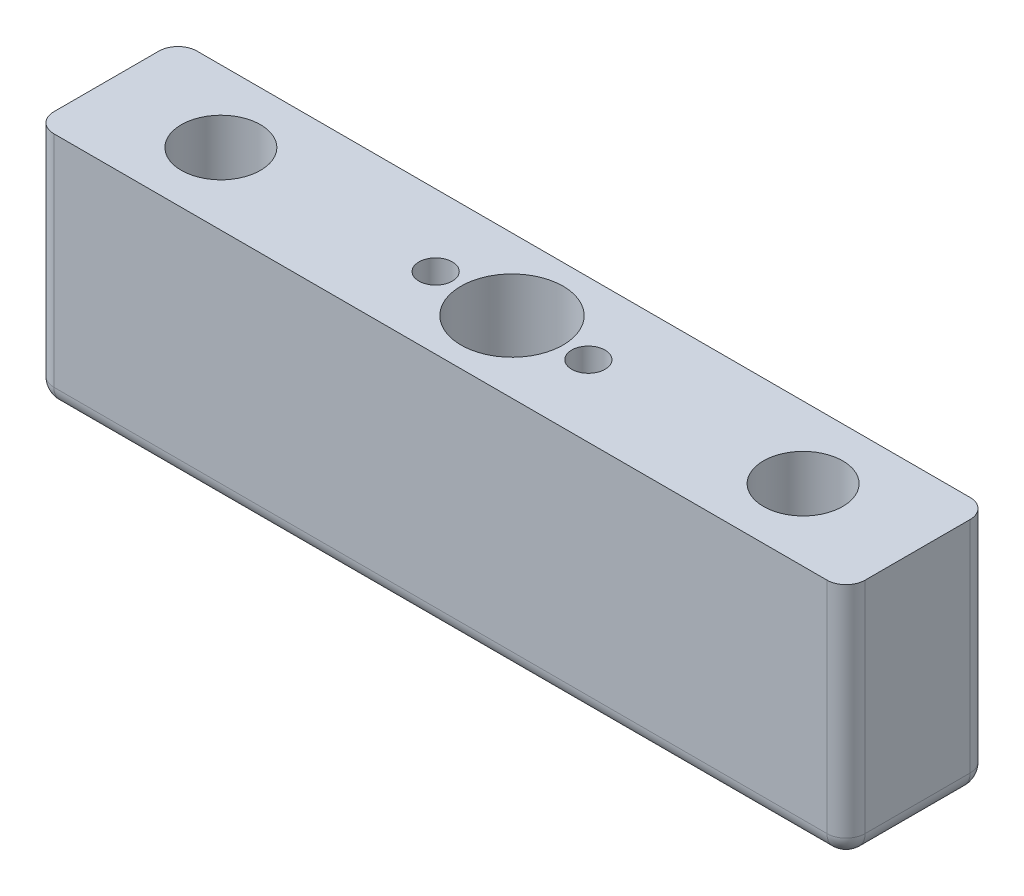
from build123d import *

# Parameters (mm, degrees)
CROQUIS1_W              = 85
CROQUIS1_H              = 15
SALIENTE_EXTRUIR1_DEPTH = 25
CROQUIS2_R              = 5.35
CORTAR_EXTRUIR1_DEPTH   = 50.874843358
CROQUIS3_R              = 4.15
CORTAR_EXTRUIR2_DEPTH   = 18
REDONDEO1_R             = 2
CROQUIS6_R              = 1.75
CORTAR_EXTRUIR4_DEPTH   = 50.874843358
CORTAR_EXTRUIR7_DEPTH   = 1


with BuildPart() as part:
    # Croquis1 → Saliente-Extruir1 (new body)
    with BuildSketch(Plane(origin=(0, 0, 0), x_dir=(1, 0, 0), z_dir=(0, 1, 0))):
        Rectangle(CROQUIS1_W, CROQUIS1_H)
    extrude(amount=SALIENTE_EXTRUIR1_DEPTH)

    # Croquis2 → Cortar-Extruir1 (cut, through all)
    with BuildSketch(Plane(origin=(0, 0, 0), x_dir=(-1, 0, 0), z_dir=(0, -1, 0))):
        with Locations(Location((0, 0, 0), (0, 0, 90))):
            Circle(CROQUIS2_R)
    extrude(amount=-CORTAR_EXTRUIR1_DEPTH, mode=Mode.SUBTRACT)

    # Croquis3 → Cortar-Extruir2 (cut)
    with BuildSketch(Plane(origin=(0, 25, 0), x_dir=(1, 0, 0), z_dir=(0, 1, 0))):
        with Locations(Location((-30.5, 0, 0), (0, 0, 270))):
            Circle(CROQUIS3_R)
        with Locations(Location((30.5, 0, 0), (0, 0, 270))):
            Circle(CROQUIS3_R)
    extrude(amount=-CORTAR_EXTRUIR2_DEPTH, mode=Mode.SUBTRACT)

    # Redondeo1
    redondeo1_edges = [part.edges().sort_by_distance(p)[0] for p in [
        (0, 0, 7.5),
        (-42.5, 0, 0),
        (0, 0, -7.5),
        (42.5, 0, 0),
        (42.5, 12.5, 7.5),
        (-42.5, 12.5, 7.5),
        (-42.5, 12.5, -7.5),
        (42.5, 12.5, -7.5),
    ]]
    fillet(redondeo1_edges, radius=REDONDEO1_R)

    # Croquis6 → Cortar-Extruir4 (cut, through all)
    with BuildSketch(Plane(origin=(0, 25, 0), x_dir=(1, 0, 0), z_dir=(0, 1, 0))):
        with Locations(Location((8, 0, 0), (0, 0, 270))):
            Circle(CROQUIS6_R)
        with Locations(Location((-8, 0, 0), (0, 0, 270))):
            Circle(CROQUIS6_R)
    extrude(amount=-CORTAR_EXTRUIR4_DEPTH, mode=Mode.SUBTRACT)

    # Croquis7 → Cortar-Extruir7 (cut)
    # profile 1 of 2: a face of its own
    with BuildSketch(Plane.XZ):
        Polygon((-15.735816649, 3.627604167), (-15.735816649, 2.333333333), (-22.735816649, 2.333333333), (-22.735816649, 2.961538462), (-16.453765367, 2.961538462), (-16.453765367, 4.038461538), align=None)
    # profile 2 of 2: a face of its own
    with BuildSketch(Plane.XZ):
        with BuildLine():
            add(Edge.make_bspline(
                [(-19.238621136, -0.269230769), (-19.126426361, -0.269886806), (-18.908486392, -0.271161165), (-18.590917108, -0.285338008), (-18.292996529, -0.308888691), (-18.014710402, -0.341163442), (-17.755986857, -0.380439385), (-17.517517395, -0.432870416), (-17.298198005, -0.492495828), (-17.097314503, -0.56160137), (-16.912157049, -0.639574708), (-16.739313868, -0.724451126), (-16.579004397, -0.819552716), (-16.428820359, -0.919606638), (-16.290437881, -1.02826913), (-16.164119024, -1.144394069), (-16.049787516, -1.269133369), (-15.946082617, -1.40001997), (-15.85574243, -1.537881039), (-15.774339916, -1.678466778), (-15.707527896, -1.824257937), (-15.652629856, -1.973924855), (-15.608641448, -2.127032284), (-15.578179561, -2.284212853), (-15.559088147, -2.445504533), (-15.557257753, -2.554366181), (-15.556329469, -2.609575321)],
                knots=[0, 0, 0, 0, 1.646377244, 3.198111528, 4.663803227, 6.031090796, 7.308794487, 8.502186765, 9.612154809, 10.642545331, 11.617106989, 12.558866172, 13.465886467, 14.35053239, 15.20542558, 16.045215227, 16.865619885, 17.686225247, 18.492864914, 19.282407821, 20.068097601, 20.842842034, 21.620163247, 22.403093475, 23.190129512, 24, 24, 24, 24], degree=3))
            add(Edge.make_bspline(
                [(-15.556329469, -2.609575321), (-15.5573051, -2.665246277), (-15.559245322, -2.775958295), (-15.577893207, -2.939639046), (-15.608835453, -3.099538409), (-15.652677402, -3.254974687), (-15.707068755, -3.40722466), (-15.77524299, -3.555097475), (-15.854600724, -3.699511638), (-15.947848479, -3.838172213), (-16.051813031, -3.972601444), (-16.169338369, -4.09949737), (-16.299237807, -4.218871542), (-16.440121535, -4.332222152), (-16.594691705, -4.436333347), (-16.760259925, -4.535480211), (-16.939721654, -4.624224283), (-17.13008259, -4.709693633), (-17.336609907, -4.783467607), (-17.558139428, -4.850000097), (-17.797287802, -4.903758035), (-18.052800293, -4.948536579), (-18.325615259, -4.983226371), (-18.61514789, -5.008491655), (-18.921588672, -5.021837825), (-19.13110437, -5.024351228), (-19.238621136, -5.025641026)],
                knots=[0, 0, 0, 0, 0.810914788, 1.612654377, 2.396697861, 3.181598691, 3.963628158, 4.749916497, 5.551656086, 6.361998678, 7.18212741, 8.025565596, 8.878627764, 9.750805457, 10.657531673, 11.591944965, 12.560506719, 13.57287815, 14.630710178, 15.753379473, 16.941251878, 18.199788006, 19.531962791, 20.947069417, 22.433333509, 24, 24, 24, 24], degree=3))
            add(Edge.make_bspline(
                [(-19.238621136, -5.025641026), (-19.345668552, -5.024336246), (-19.554246076, -5.021793936), (-19.859313556, -5.008658775), (-20.147290215, -4.982663334), (-20.41897767, -4.950511076), (-20.672762824, -4.904710628), (-20.911058869, -4.85264359), (-21.131809347, -4.787929851), (-21.337247456, -4.71516142), (-21.526675746, -4.631546669), (-21.704586114, -4.542018264), (-21.870019237, -4.443479984), (-22.024587159, -4.338747894), (-22.166692715, -4.226360749), (-22.296687112, -4.106481098), (-22.414484608, -3.979017693), (-22.519869643, -3.844284532), (-22.612031928, -3.703442631), (-22.694410187, -3.559510505), (-22.761255036, -3.409615396), (-22.817693438, -3.257088604), (-22.861636248, -3.100490939), (-22.891723593, -2.939976001), (-22.912883478, -2.776069471), (-22.914494251, -2.665265538), (-22.915303828, -2.609575321)],
                knots=[0, 0, 0, 0, 1.56130642, 3.042141888, 4.451772327, 5.777565838, 7.030558081, 8.211376819, 9.333164717, 10.383253789, 11.387583522, 12.350962576, 13.286244149, 14.193812918, 15.072134482, 15.925989337, 16.770211267, 17.600669898, 18.417446232, 19.22325363, 20.01647746, 20.807971184, 21.593601364, 22.38506573, 23.188331689, 24, 24, 24, 24], degree=3))
            add(Edge.make_bspline(
                [(-22.915303828, -2.609575321), (-22.914366612, -2.554368424), (-22.912518605, -2.445511199), (-22.893556216, -2.284187121), (-22.86263495, -2.127251692), (-22.820644024, -1.974391185), (-22.767276046, -1.825292768), (-22.699393956, -1.681417008), (-22.620661292, -1.5408638), (-22.531088152, -1.404274494), (-22.428439667, -1.274252399), (-22.314913491, -1.150052566), (-22.187662157, -1.034810992), (-22.048722516, -0.927510387), (-21.899273474, -0.825687939), (-21.737842843, -0.731518276), (-21.563380224, -0.646807414), (-21.377200643, -0.567086628), (-21.174840747, -0.496812905), (-20.954351598, -0.435206972), (-20.7145135, -0.383849808), (-20.456038463, -0.342548111), (-20.178733027, -0.308499017), (-19.882108942, -0.285449523), (-19.566422129, -0.271149875), (-19.349882069, -0.269882145), (-19.238621136, -0.269230769)],
                knots=[0, 0, 0, 0, 0.810940842, 1.599017053, 2.38298203, 3.159479784, 3.926441347, 4.70693857, 5.494146311, 6.292334103, 7.104379492, 7.925868426, 8.762126819, 9.623561095, 10.503686106, 11.41783325, 12.366995289, 13.351843594, 14.392337808, 15.512229747, 16.713911458, 17.994391108, 19.357476964, 20.818259213, 22.365182633, 24, 24, 24, 24], degree=3))
        make_face()
        with BuildLine():
            add(Edge.make_bspline(
                [(-19.235816649, -0.897435897), (-19.329314047, -0.897674792), (-19.510774136, -0.898138438), (-19.774460658, -0.91025084), (-20.020401317, -0.926751302), (-20.248908385, -0.948033902), (-20.459208427, -0.97963978), (-20.652747737, -1.015053418), (-20.828502395, -1.058149393), (-20.987677411, -1.109140103), (-21.132977611, -1.167215999), (-21.268172835, -1.230635754), (-21.394902211, -1.298728786), (-21.511878588, -1.375068296), (-21.620266383, -1.457922738), (-21.719754119, -1.547428165), (-21.809907706, -1.643427165), (-21.916883678, -1.77632125), (-22.028736694, -1.950902188), (-22.124938828, -2.171995858), (-22.185786987, -2.39927863), (-22.19350354, -2.553588256), (-22.197355111, -2.630608974)],
                knots=[0, 0, 0, 0, 1.459116078, 2.831857795, 4.118796693, 5.306371758, 6.412361096, 7.436813035, 8.376339383, 9.234574298, 10.043323891, 10.816788787, 11.564361537, 12.286735248, 12.994408768, 13.691741332, 14.372975427, 15.047457468, 16.352811911, 17.594285292, 18.799233213, 20, 20, 20, 20], degree=3))
            add(Edge.make_bspline(
                [(-22.197355111, -2.630608974), (-22.194159549, -2.708124318), (-22.187775023, -2.862994964), (-22.126177549, -3.089262554), (-22.03323847, -3.308923094), (-21.923343459, -3.481066975), (-21.8186868, -3.612032062), (-21.729457503, -3.705866042), (-21.629545769, -3.791990139), (-21.521747177, -3.873674289), (-21.404002208, -3.94859244), (-21.276877058, -4.016718716), (-21.140018702, -4.078885411), (-21.044479224, -4.114303503), (-20.995632354, -4.132411859)],
                knots=[0, 0, 0, 0, 1.353760809, 2.704726607, 4.075137775, 5.516104923, 6.260822281, 7.007110065, 7.778089737, 8.566572457, 9.372053459, 10.217411131, 11.088608312, 12, 12, 12, 12], degree=3))
            add(Edge.make_bspline(
                [(-20.995632354, -4.132411859), (-20.933172875, -4.153515395), (-20.806353347, -4.196364622), (-20.609626043, -4.251588171), (-20.403220515, -4.295078969), (-20.188370281, -4.334205701), (-19.963490879, -4.360911812), (-19.729278111, -4.382407439), (-19.485555387, -4.395068813), (-19.319965404, -4.396638315), (-19.235816649, -4.397435897)],
                knots=[0, 0, 0, 0, 0.884706709, 1.796334032, 2.740027952, 3.714592787, 4.726048262, 5.777819803, 6.87074269, 8, 8, 8, 8], degree=3))
            add(Edge.make_bspline(
                [(-19.235816649, -4.397435897), (-19.151669702, -4.396556249), (-18.987039924, -4.394835257), (-18.746186408, -4.383528181), (-18.517027725, -4.365358649), (-18.299355986, -4.340766586), (-18.093558624, -4.307006884), (-17.899341146, -4.266464843), (-17.716755909, -4.218933951), (-17.545332043, -4.164414601), (-17.38568569, -4.102972048), (-17.237469269, -4.03509645), (-17.099897025, -3.962663991), (-16.973363843, -3.883976736), (-16.857298581, -3.799986068), (-16.754029437, -3.708470792), (-16.660355489, -3.613062092), (-16.553430354, -3.479427706), (-16.444406962, -3.304479133), (-16.344075443, -3.086787836), (-16.286458857, -2.860246548), (-16.278335483, -2.70709964), (-16.274278187, -2.630608974)],
                knots=[0, 0, 0, 0, 1.313668642, 2.570134578, 3.763346207, 4.902004944, 5.98888779, 7.017888835, 7.998425394, 8.933058446, 9.82474457, 10.667209444, 11.476765193, 12.250262638, 12.991704352, 13.7104269, 14.401925311, 15.076585796, 16.378385137, 17.609787933, 18.806186071, 20, 20, 20, 20], degree=3))
            add(Edge.make_bspline(
                [(-16.274278187, -2.630608974), (-16.278335846, -2.553184539), (-16.286458556, -2.39819462), (-16.343924357, -2.169347957), (-16.443472852, -1.950105943), (-16.554134391, -1.776560965), (-16.658462613, -1.643095185), (-16.749186831, -1.54884971), (-16.848975533, -1.460740005), (-16.956904441, -1.377816535), (-17.073939817, -1.301550513), (-17.200650763, -1.233429615), (-17.335858551, -1.170046263), (-17.481125692, -1.111845682), (-17.640540674, -1.061327523), (-17.815408316, -1.016173608), (-18.0091284, -0.980781455), (-18.220016384, -0.949896763), (-18.44880436, -0.926348938), (-18.695312028, -0.910293198), (-18.959454547, -0.898116523), (-19.141850896, -0.897667316), (-19.235816649, -0.897435897)],
                knots=[0, 0, 0, 0, 1.207964612, 2.418129846, 3.655795183, 4.951004962, 5.620895151, 6.296795572, 6.989224116, 7.696855977, 8.419187164, 9.166715907, 9.940135271, 10.748837255, 11.607021648, 12.548275234, 13.5654991, 14.678641405, 15.874140913, 17.15372626, 18.533675393, 20, 20, 20, 20], degree=3))
        make_face(mode=Mode.SUBTRACT)
    extrude(amount=-CORTAR_EXTRUIR7_DEPTH, mode=Mode.SUBTRACT)


solid = part.part
